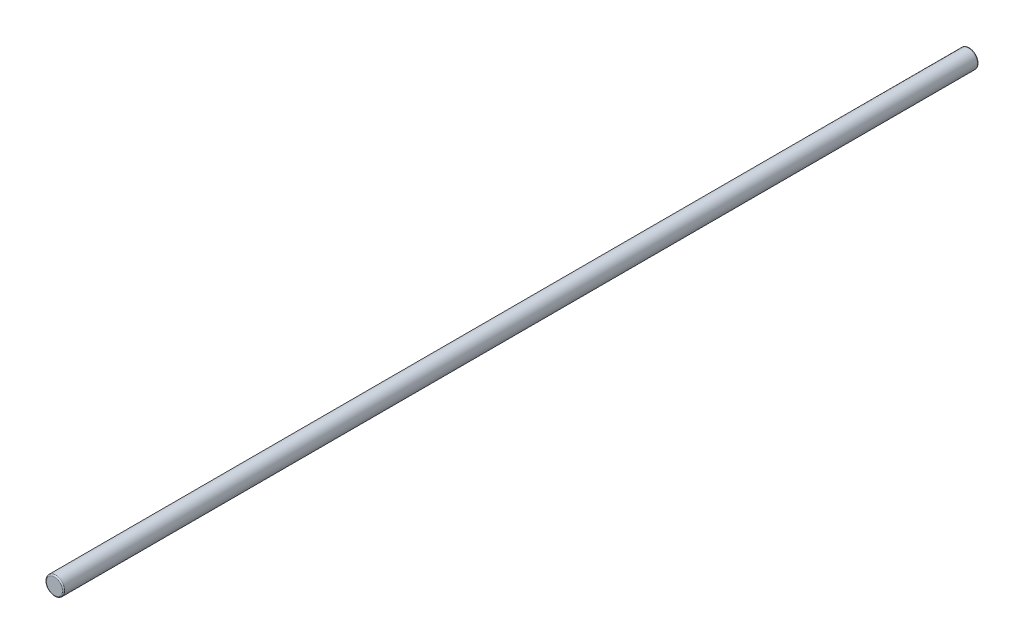
from build123d import *

# Parameters (mm, degrees)
CROQUIS1_R              = 4
SALIENTE_EXTRUIR1_DEPTH = 400
REDONDEO1_R             = 0.5


with BuildPart() as part:
    # Croquis1 → Saliente-Extruir1 (new body)
    with BuildSketch(Plane.XY):
        Circle(CROQUIS1_R)
    extrude(amount=SALIENTE_EXTRUIR1_DEPTH)

    # Redondeo1
    redondeo1_edges = [part.edges().sort_by_distance(p)[0] for p in [
        (-4, 0, 0),
        (-4, 0, 400),
    ]]
    fillet(redondeo1_edges, radius=REDONDEO1_R)


solid = part.part
